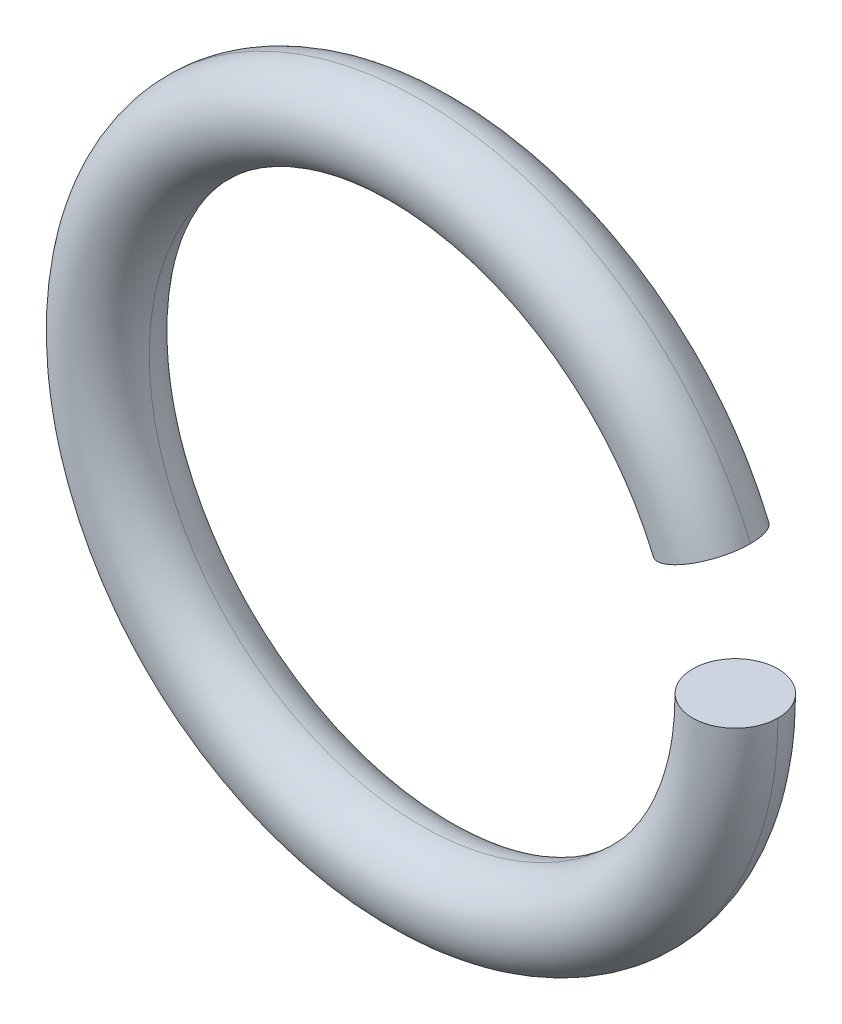
from build123d import *

# Parameters (mm, degrees)
SKETCH2_R = 0.4


with BuildPart() as part:
    # Sweep1: sweep along a path in Sketch1
    with BuildLine(Plane.XY) as sweep1_path:
        ThreePointArc((2.353921569, 0.980588216), (-2.50049995, -0.5), (2.55, 0))
    # Sketch2 → Sweep1 (sweep)
    with BuildSketch(Plane(origin=(0, 0, 0), x_dir=(1, 0, 0), z_dir=(0, 1, 0))):
        with Locations((2.95, 0)):
            Circle(SKETCH2_R)
    sweep(path=sweep1_path.line)


solid = part.part
